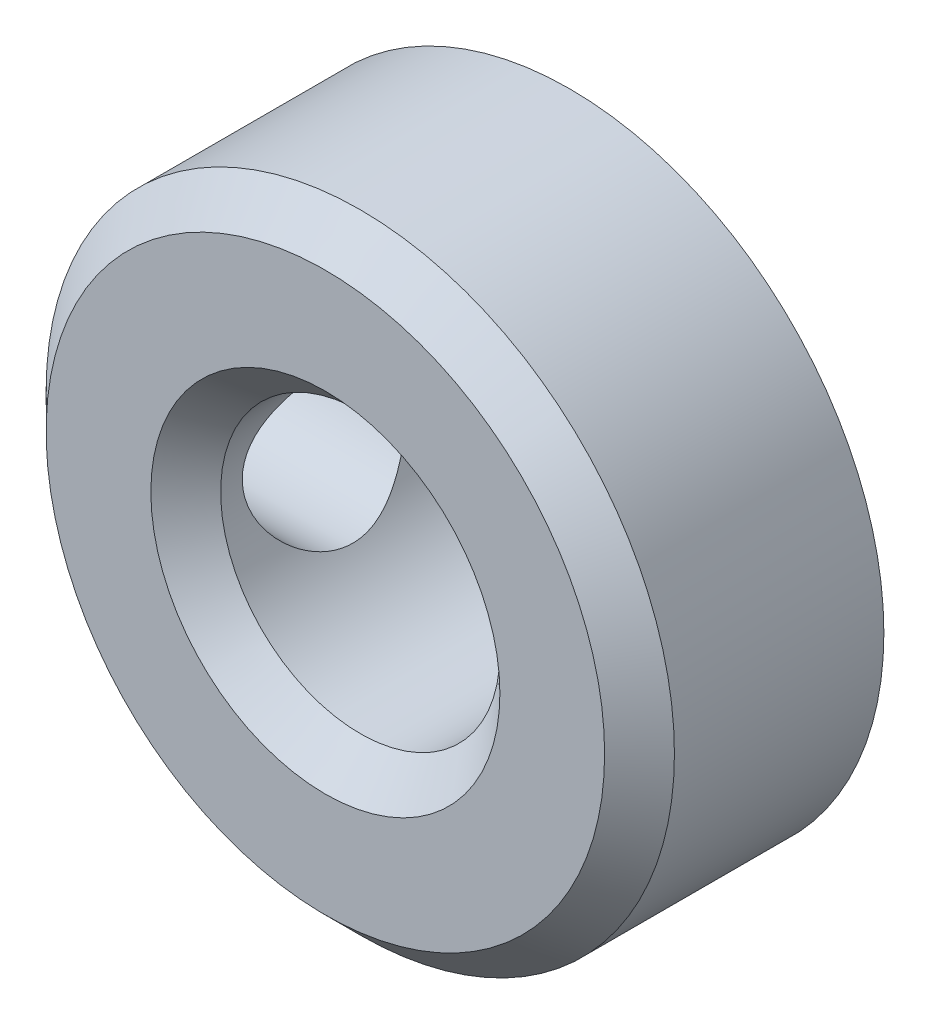
from build123d import *

# Parameters (mm, degrees)
CROQUIS1_R              = 9
SALIENTE_EXTRUIR1_DEPTH = 8
CROQUIS2_R              = 4
CORTAR_EXTRUIR1_DEPTH   = 16.033296378
CHAFL_N1_SIZE           = 1
CROQUIS3_R              = 2.38125
CORTAR_EXTRUIR2_DEPTH   = 10
CROQUIS4_R              = 11.390520889
CROQUIS4_R_2            = 5.5
CORTAR_EXTRUIR3_DEPTH   = 1


with BuildPart() as part:
    # Croquis1 → Saliente-Extruir1 (new body)
    with BuildSketch(Plane.XY):
        Circle(CROQUIS1_R)
    extrude(amount=SALIENTE_EXTRUIR1_DEPTH)

    # Croquis2 → Cortar-Extruir1 (cut, through all)
    with BuildSketch(Plane.XY.offset(8)):
        Circle(CROQUIS2_R)
    extrude(amount=-CORTAR_EXTRUIR1_DEPTH, mode=Mode.SUBTRACT)

    # Chaflán1
    chafl_n1_edges = [part.edges().sort_by_distance(p)[0] for p in [
        (-9, 0, 8),
        (-4, 0, 8),
    ]]
    chamfer(chafl_n1_edges, length=CHAFL_N1_SIZE)

    # Croquis3 → Cortar-Extruir2 (cut)
    with BuildSketch(Plane(origin=(0, 0, 0), x_dir=(0, 0, -1), z_dir=(1, 0, 0))):
        with Locations((-4, 0)):
            Circle(CROQUIS3_R)
    extrude(amount=-CORTAR_EXTRUIR2_DEPTH, mode=Mode.SUBTRACT)

    # Croquis4 → Cortar-Extruir3 (cut)
    with BuildSketch(Plane(origin=(0, 0, 0), x_dir=(-1, 0, 0), z_dir=(0, 0, -1))):
        Circle(CROQUIS4_R)
        Circle(CROQUIS4_R_2, mode=Mode.SUBTRACT)
    extrude(amount=-CORTAR_EXTRUIR3_DEPTH, mode=Mode.SUBTRACT)


solid = part.part
